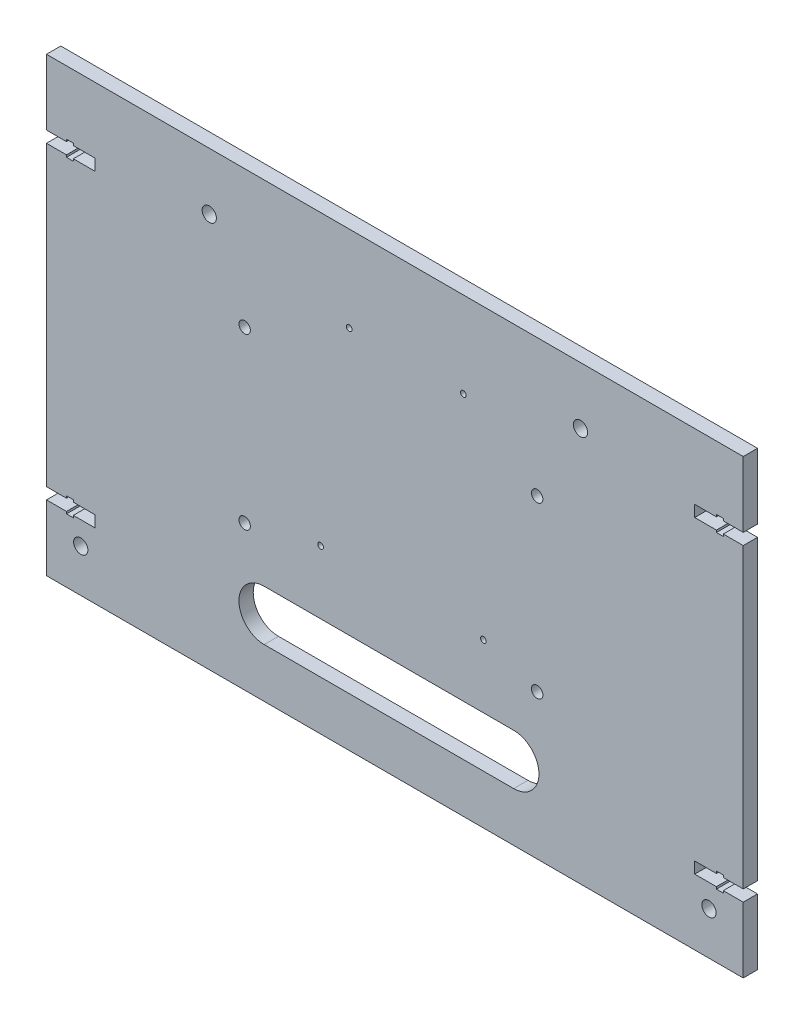
from build123d import *

# Parameters (mm, degrees)
SKETCH1_W           = 244
SKETCH1_H           = 158.15
BOSS_EXTRUDE1_DEPTH = 5
CUT_EXTRUDE1_DEPTH  = 10
SKETCH3_R           = 2.5
CUT_EXTRUDE2_DEPTH  = 10
SKETCH4_R           = 1
CUT_EXTRUDE3_DEPTH  = 10
SKETCH5_R           = 2
CUT_EXTRUDE4_DEPTH  = 10
CUT_EXTRUDE5_DEPTH  = 10


with BuildPart() as part:
    # Sketch1 → Boss-Extrude1 (new body)
    with BuildSketch(Plane.XY):
        with Locations((14.8, -10.925)):
            Rectangle(SKETCH1_W, SKETCH1_H)
    extrude(amount=BOSS_EXTRUDE1_DEPTH)

    # Sketch2 → Cut-Extrude1 (cut)
    with BuildSketch(Plane(origin=(0, 0, 0), x_dir=(-1, 0, 0), z_dir=(0, 0, -1))):
        Polygon((-136.8, 45.15), (-129.8, 45.15), (-129.8, 45.9), (-127.4, 45.9), (-127.4, 45.15), (-119.8, 45.15), (-119.8, 41.15), (-127.4, 41.15), (-127.4, 40.4), (-129.8, 40.4), (-129.8, 41.15), (-136.8, 41.15), align=None)
        Polygon((-129.8, -63), (-136.8, -63), (-136.8, -67), (-129.8, -67), (-129.8, -67.75), (-127.4, -67.75), (-127.4, -67), (-119.8, -67), (-119.8, -63), (-127.4, -63), (-127.4, -62.25), (-129.8, -62.25), align=None)
        Polygon((100.2, 41.15), (107.2, 41.15), (107.2, 45.15), (100.2, 45.15), (100.2, 45.9), (97.8, 45.9), (97.8, 45.15), (90.2, 45.15), (90.2, 41.15), (97.8, 41.15), (97.8, 40.4), (100.2, 40.4), align=None)
        Polygon((107.2, -67), (100.2, -67), (100.2, -67.75), (97.8, -67.75), (97.8, -67), (90.2, -67), (90.2, -63), (97.8, -63), (97.8, -62.25), (100.2, -62.25), (100.2, -63), (107.2, -63), align=None)
    extrude(amount=-CUT_EXTRUDE1_DEPTH, mode=Mode.SUBTRACT)

    # Sketch3 → Cut-Extrude2 (cut)
    with BuildSketch(Plane(origin=(0, 0, 0), x_dir=(-1, 0, 0), z_dir=(0, 0, -1))):
        with Locations((-124.8, -75.004567899)):
            Circle(SKETCH3_R)
        with Locations((-79.8, 48.15)):
            Circle(SKETCH3_R)
        with Locations((95.2, -75.004567899)):
            Circle(SKETCH3_R)
        with Locations((50.2, 48.15)):
            Circle(SKETCH3_R)
    extrude(amount=-CUT_EXTRUDE2_DEPTH, mode=Mode.SUBTRACT)

    # Sketch4 → Cut-Extrude3 (cut)
    with BuildSketch(Plane(origin=(0, 0, 0), x_dir=(-1, 0, 0), z_dir=(0, 0, -1))):
        with Locations((-38.8, 38.15)):
            Circle(SKETCH4_R)
        with Locations((1.2, 38.15)):
            Circle(SKETCH4_R)
        with Locations((-45.8, -32.925)):
            Circle(SKETCH4_R)
        with Locations((11.2, -32.925)):
            Circle(SKETCH4_R)
    extrude(amount=-CUT_EXTRUDE3_DEPTH, mode=Mode.SUBTRACT)

    # Sketch5 → Cut-Extrude4 (cut)
    with BuildSketch(Plane(origin=(0, 0, 0), x_dir=(-1, 0, 0), z_dir=(0, 0, -1))):
        with Locations((-64.634291995, 20.08216582)):
            Circle(SKETCH5_R)
        with Locations((37.798280732, 20.08216582)):
            Circle(SKETCH5_R)
        with Locations((37.798280732, -39.300167224)):
            Circle(SKETCH5_R)
        with Locations((-64.634291995, -39.300167224)):
            Circle(SKETCH5_R)
    extrude(amount=-CUT_EXTRUDE4_DEPTH, mode=Mode.SUBTRACT)

    # Sketch6 → Cut-Extrude5 (cut)
    with BuildSketch(Plane(origin=(0, 0, 0), x_dir=(-1, 0, 0), z_dir=(0, 0, -1))):
        with BuildLine():
            Line((-56.414434421, -72.751869016), (30.959965679, -72.751869016))
            ThreePointArc((30.959965679, -72.751869016), (39.799882323, -63.911952372), (30.959965679, -55.072035728))
            Line((30.959965679, -55.072035728), (-56.414434421, -55.072035728))
            ThreePointArc((-56.414434421, -55.072035728), (-65.254351065, -63.911952372), (-56.414434421, -72.751869016))
        make_face()
    extrude(amount=-CUT_EXTRUDE5_DEPTH, mode=Mode.SUBTRACT)


solid = part.part
